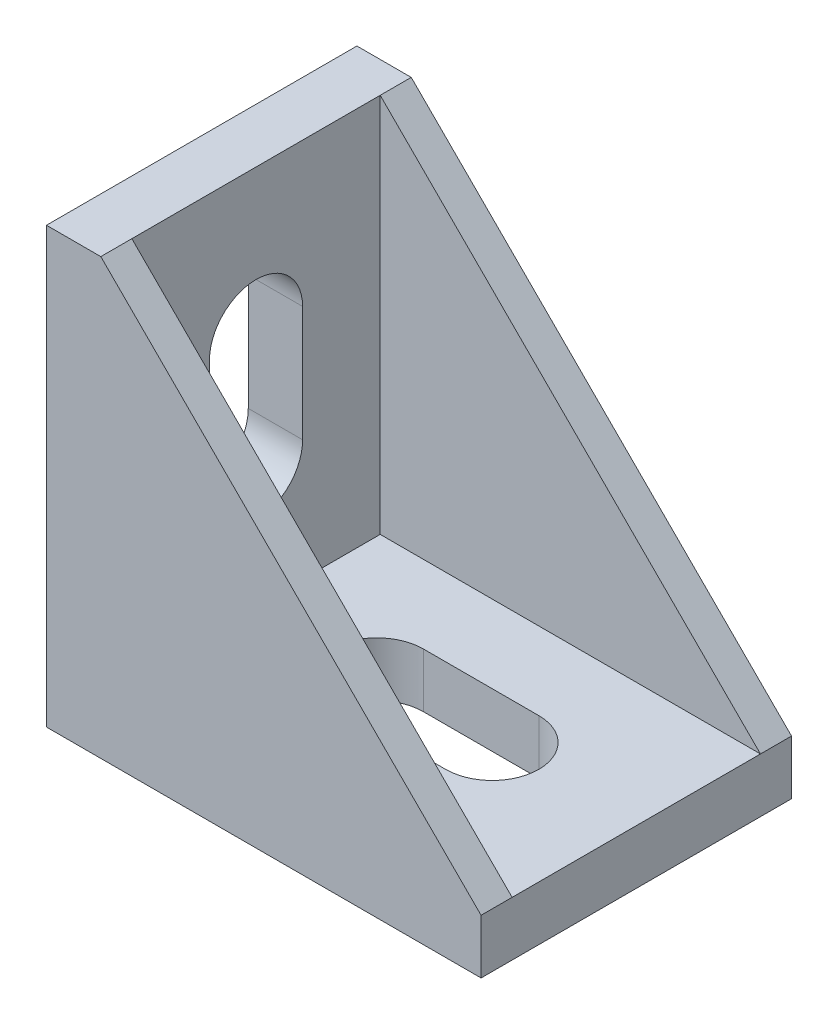
from build123d import *

# Parameters (mm, degrees)
SKETCH1_W           = 20
SKETCH1_H           = 28
BOSS_EXTRUDE1_DEPTH = 3.5
SKETCH2_W           = 20
SKETCH2_H           = 3.5
BOSS_EXTRUDE2_DEPTH = 24.5
BOSS_EXTRUDE3_DEPTH = 2
BOSS_EXTRUDE4_DEPTH = 2
CUT_EXTRUDE1_DEPTH  = 43.240383521
CUT_EXTRUDE2_DEPTH  = 43.240383521


with BuildPart() as part:
    # Sketch1 → Boss-Extrude1 (new body)
    with BuildSketch(Plane(origin=(0, 0, 0), x_dir=(0, 0, -1), z_dir=(1, 0, 0))):
        with Locations((10, 14)):
            Rectangle(SKETCH1_W, SKETCH1_H)
    extrude(amount=BOSS_EXTRUDE1_DEPTH)

    # Sketch2 → Boss-Extrude2 (add)
    with BuildSketch(Plane(origin=(3.5, 0, 0), x_dir=(0, 0, -1), z_dir=(1, 0, 0))):
        with Locations((10, 1.75)):
            Rectangle(SKETCH2_W, SKETCH2_H)
    extrude(amount=BOSS_EXTRUDE2_DEPTH)

    # Sketch3 → Boss-Extrude3 (add)
    with BuildSketch(Plane(origin=(0, 0, -20), x_dir=(-1, 0, 0), z_dir=(0, 0, -1))):
        Polygon((-28, 0), (-28, 3.5), (-3.5, 28), (0, 28), (0, 0), align=None)
    extrude(amount=-BOSS_EXTRUDE3_DEPTH)

    # Sketch4 → Boss-Extrude4 (add)
    with BuildSketch(Plane.XY):
        Polygon((3.5, 28), (0, 28), (0, 0), (28, 0), (28, 3.5), align=None)
    extrude(amount=-BOSS_EXTRUDE4_DEPTH)

    # Sketch5 → Cut-Extrude1 (cut, through all)
    with BuildSketch(Plane(origin=(0, 3.5, 0), x_dir=(1, 0, 0), z_dir=(0, 1, 0))):
        with BuildLine():
            Line((18.718782713, 7), (11.281217287, 7))
            ThreePointArc((11.281217287, 7), (8.281217287, 10), (11.281217287, 13))
            Line((11.281217287, 13), (18.718782713, 13))
            ThreePointArc((18.718782713, 13), (21.718782713, 10), (18.718782713, 7))
        make_face()
    extrude(amount=-CUT_EXTRUDE1_DEPTH, mode=Mode.SUBTRACT)

    # Sketch6 → Cut-Extrude2 (cut, through all)
    with BuildSketch(Plane(origin=(3.5, 0, 0), x_dir=(0, 0, -1), z_dir=(1, 0, 0))):
        with BuildLine():
            Line((7, 11.28), (7, 18.72))
            ThreePointArc((7, 18.72), (10, 21.72), (13, 18.72))
            Line((13, 18.72), (13, 11.28))
            ThreePointArc((13, 11.28), (10, 8.28), (7, 11.28))
        make_face()
    extrude(amount=-CUT_EXTRUDE2_DEPTH, mode=Mode.SUBTRACT)


solid = part.part
